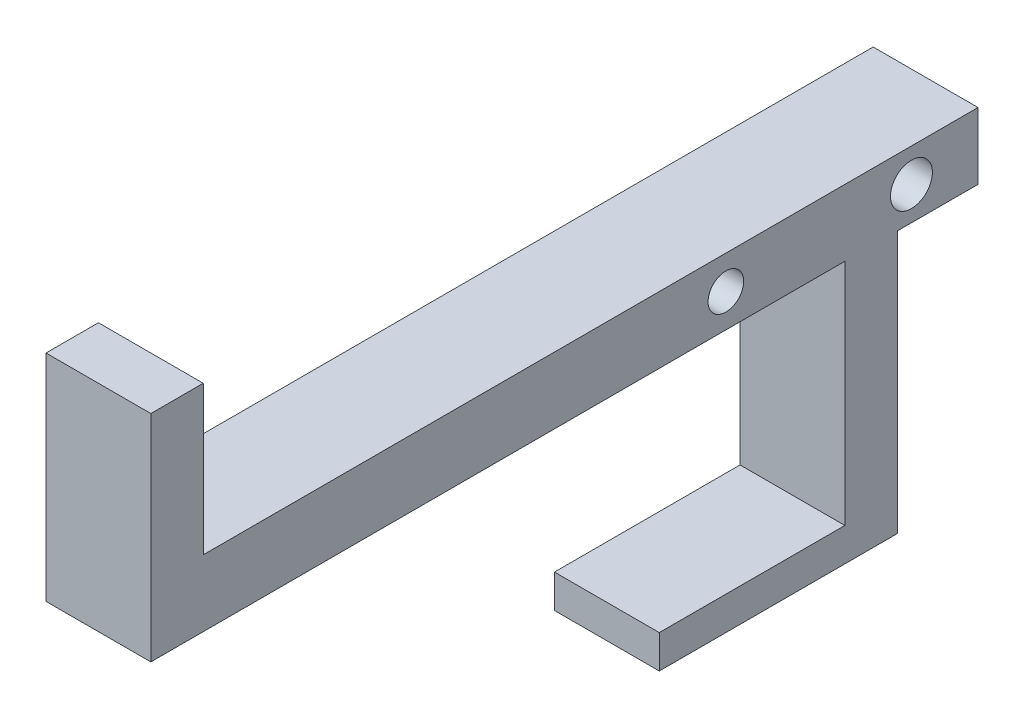
from build123d import *

# Parameters (mm, degrees)
SKETCH1_W           = 5
SKETCH1_H           = 14.17103806
BOSS_EXTRUDE1_DEPTH = 10


with BuildPart() as part:
    # Sketch1 → Boss-Extrude1 (new body)
    with BuildSketch(Plane(origin=(0, 0, 0), x_dir=(0, 0, -1), z_dir=(1, 0, 0))):
        with BuildLine():
            Line((-61.2, 21.825), (-6.35, 21.825))
            Line((-6.35, 21.825), (-6.35, 23.3))
            ThreePointArc((-6.35, 23.3), (-8.05, 25), (-6.35, 26.7))
            Line((-6.35, 26.7), (-6.35, 28.175))
            Line((-6.35, 28.175), (-56.2, 28.175))
            Line((-56.2, 28.175), (-61.2, 28.175))
            Line((-61.2, 28.175), (-61.2, 21.825))
        make_face()
        with BuildLine():
            Line((-6.35, 21.825), (0, 21.825))
            Line((0, 21.825), (5, 21.825))
            Line((5, 21.825), (10, 21.825))
            Line((10, 21.825), (17.7, 21.825))
            Line((17.7, 21.825), (17.7, 25))
            Line((17.7, 25), (13.35, 25))
            ThreePointArc((13.35, 25), (11.35, 23), (9.35, 25))
            Line((9.35, 25), (-4.65, 25))
            ThreePointArc((-4.65, 25), (-5.147918472, 23.797918472), (-6.35, 23.3))
            Line((-6.35, 23.3), (-6.35, 21.825))
        make_face()
        with BuildLine():
            Line((-6.35, 28.175), (-6.35, 26.7))
            ThreePointArc((-6.35, 26.7), (-5.147918472, 26.202081528), (-4.65, 25))
            Line((-4.65, 25), (9.35, 25))
            ThreePointArc((9.35, 25), (11.35, 27), (13.35, 25))
            Line((13.35, 25), (17.7, 25))
            Line((17.7, 25), (17.7, 28.175))
            Line((17.7, 28.175), (-6.35, 28.175))
        make_face()
        Polygon((5, 21.825), (5, 0), (5, -3.175), (10, -3.175), (10, 21.825), align=None)
        Polygon((5, 0), (0, 0), (-12.7, 0), (-12.7, -3.175), (5, -3.175), align=None)
        with Locations((-58.7, 35.26051903)):
            Rectangle(SKETCH1_W, SKETCH1_H)
    extrude(amount=BOSS_EXTRUDE1_DEPTH)


solid = part.part
